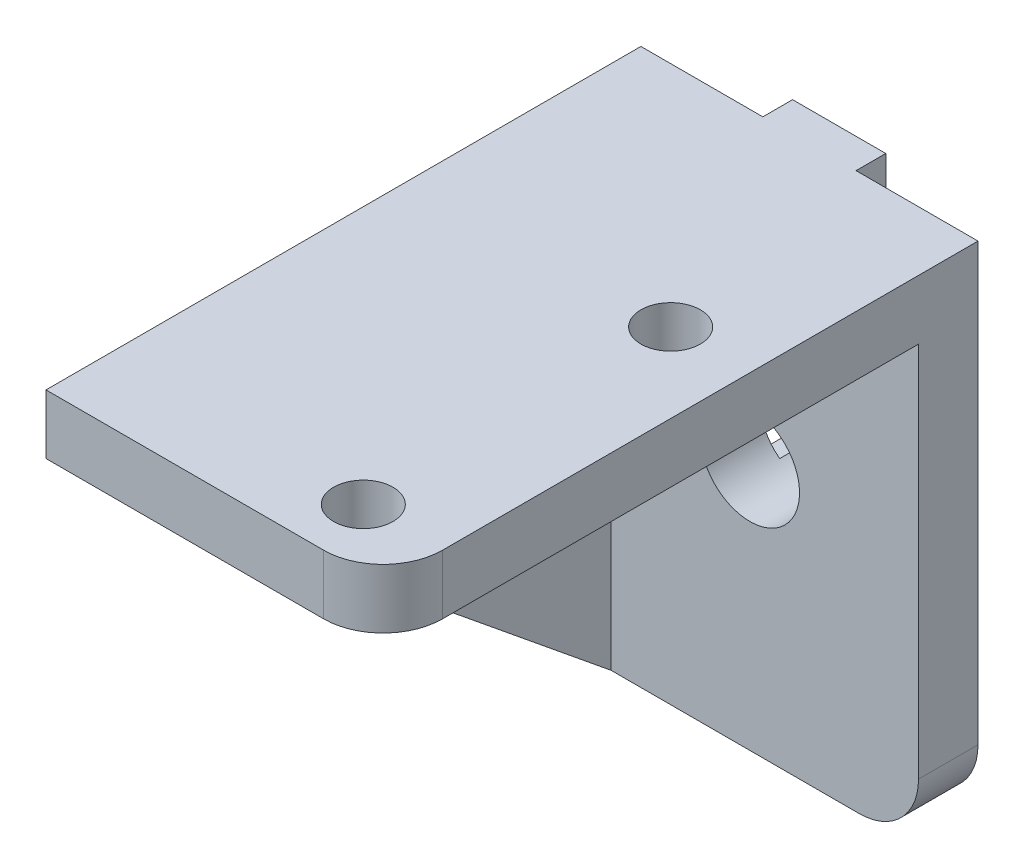
from build123d import *

# Parameters (mm, degrees)
BOSS_EXTRU_1_DEPTH           = 12.5
ENL_V_MAT_EXTRU_1_DEPTH      = 34.966383385
ENL_V_MAT_EXTRU_1_DEPTH_BACK = 34.966383385
ESQUISSE2_R                  = 2.5
ESQUISSE5_W                  = 1.5
ESQUISSE5_H                  = 4
ENL_V_MAT_EXTRU_3_DEPTH      = 35.263282096
ESQUISSE6_W                  = 17
ESQUISSE6_H                  = 30
ESQUISSE6_R                  = 1.5
BOSS_EXTRU_2_DEPTH           = 3
ENL_V_MAT_EXTRU_4_DEPTH      = 37.006943775
CONG_1_R                     = 3


with BuildPart() as part:
    # Esquisse1 → Boss.-Extru.1 (new, symmetric)
    with BuildSketch(Plane(origin=(0, 0, 0), x_dir=(1, 0, 0), z_dir=(0, 1, 0))):
        Polygon((2.35, 0), (8.5, 0), (8.5, -3), (-7, -3), (-7, -30), (-8.5, -30), (-8.5, 0), (-2.35, 0), (-2.35, 1.5), (2.35, 1.5), align=None)
    extrude(amount=BOSS_EXTRU_1_DEPTH, both=True)

    # Esquisse2 → Enlèv. mat.-Extru.1 (cut, two sides: drawn at the far end of the back side and taken through both)
    with BuildSketch(Plane(origin=(-1.372446517, 0, 0), x_dir=(1, 0, 0), z_dir=(0, 0, 1)).offset(-ENL_V_MAT_EXTRU_1_DEPTH_BACK)):
        with Locations(Location((1.372446517, 0, 0), (0, 0, 340.051556411))):
            Circle(ESQUISSE2_R)
    extrude(amount=ENL_V_MAT_EXTRU_1_DEPTH + ENL_V_MAT_EXTRU_1_DEPTH_BACK, mode=Mode.SUBTRACT)

    # Esquisse5 → Enlèv. mat.-Extru.3 (cut, through all)
    with BuildSketch(Plane.ZY.offset(2.35)):
        with Locations((-0.75, 0)):
            Rectangle(ESQUISSE5_W, ESQUISSE5_H)
    extrude(amount=-ENL_V_MAT_EXTRU_3_DEPTH, mode=Mode.SUBTRACT)

    # Esquisse6 → Boss.-Extru.2 (add)
    with BuildSketch(Plane(origin=(0, 12.5, 0), x_dir=(1, 0, 0), z_dir=(0, 1, 0))):
        with Locations((0, -15)):
            Rectangle(ESQUISSE6_W, ESQUISSE6_H)
        with Locations(Location((4.5, -27, 0), (0, 0, 270))):
            Circle(ESQUISSE6_R, mode=Mode.SUBTRACT)
        with Locations(Location((4.5, -11.5, 0), (0, 0, 270))):
            Circle(ESQUISSE6_R, mode=Mode.SUBTRACT)
    extrude(amount=-BOSS_EXTRU_2_DEPTH)

    # Esquisse7 → Enlèv. mat.-Extru.4 (cut, through all)
    with BuildSketch(Plane(origin=(-7, 0, 0), x_dir=(0, 0, -1), z_dir=(1, 0, 0))):
        Polygon((-30, 9.5), (-3, -12.5), (-30, -12.5), align=None)
    extrude(amount=-ENL_V_MAT_EXTRU_4_DEPTH, mode=Mode.SUBTRACT)

    # Congé1
    cong_1_edges = [part.edges().sort_by_distance(p)[0] for p in [
        (8.5, -12.5, 1.5),
        (8.5, 11, 30),
    ]]
    fillet(cong_1_edges, radius=CONG_1_R)


solid = part.part
